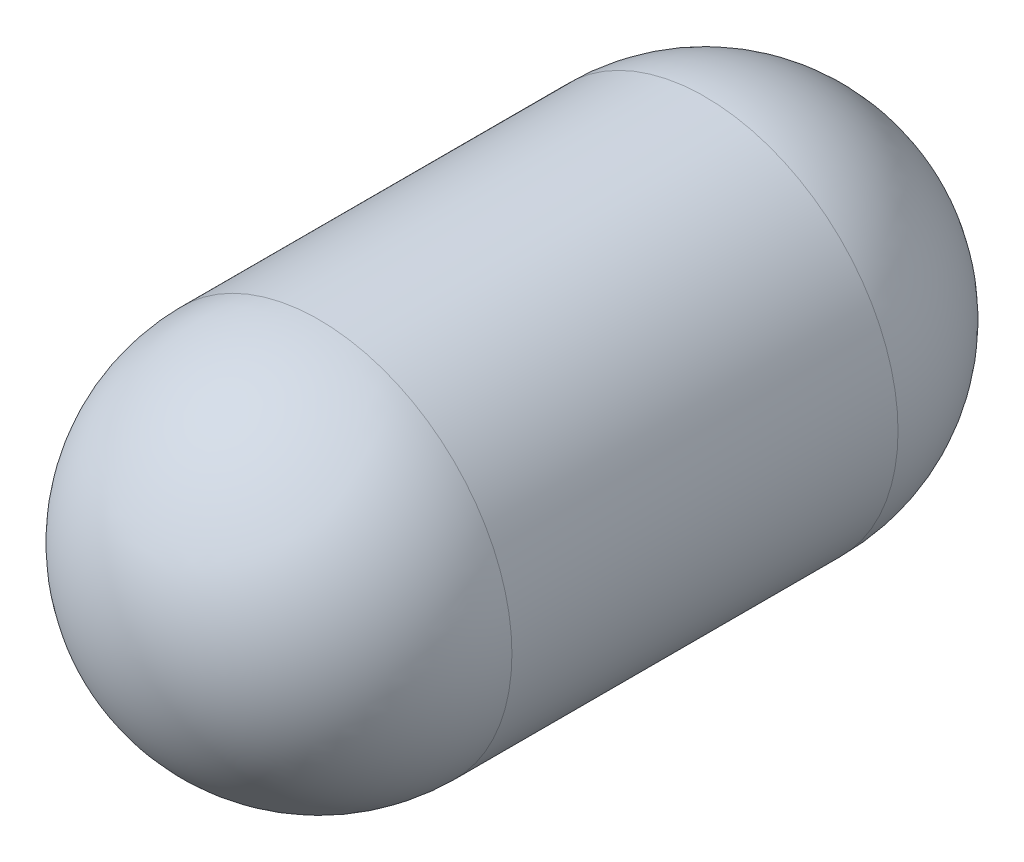
from build123d import *
from build123d.topology import SkipClean

# Parameters (mm, degrees)
BOSS_EXTRUDE1_DEPTH      = 0.5
BOSS_EXTRUDE1_DEPTH_BACK = 0.5
SKETCH1_R                = 0.5
DOME1_FACE_RADIUS        = 0.5
DOME1_HEIGHT             = 0.5
DOME2_FACE_RADIUS        = 0.5
DOME2_HEIGHT             = 0.5


with BuildPart() as part:
    # Sketch1 → Boss-Extrude1 (new, two sides: drawn at the far end of the back side and taken through both)
    with BuildSketch(Plane.XY.offset(-BOSS_EXTRUDE1_DEPTH_BACK)):
        Circle(SKETCH1_R)
    extrude(amount=BOSS_EXTRUDE1_DEPTH + BOSS_EXTRUDE1_DEPTH_BACK)

    # Dome1: a dome of height H over a round flat face of radius A is a cap of a sphere of radius (A * A + H * H) / (2 * H)
    dome1_r = (DOME1_FACE_RADIUS * DOME1_FACE_RADIUS + DOME1_HEIGHT * DOME1_HEIGHT) / (2 * DOME1_HEIGHT)
    dome1_base = Plane((0, 0, 0.5), z_dir=(0, 0, 1))
    with Locations(dome1_base.offset(DOME1_HEIGHT - dome1_r)):
        dome1_ball = Sphere(dome1_r, mode=Mode.PRIVATE)
    add(split(dome1_ball, bisect_by=dome1_base, keep=Keep.TOP, mode=Mode.PRIVATE))

    # Dome2: a dome of height H over a round flat face of radius A is a cap of a sphere of radius (A * A + H * H) / (2 * H)
    dome2_r = (DOME2_FACE_RADIUS * DOME2_FACE_RADIUS + DOME2_HEIGHT * DOME2_HEIGHT) / (2 * DOME2_HEIGHT)
    dome2_base = Plane((0, 0, -0.5), z_dir=(0, 0, -1))
    with Locations(dome2_base.offset(DOME2_HEIGHT - dome2_r)):
        dome2_ball = Sphere(dome2_r, mode=Mode.PRIVATE)
    add(split(dome2_ball, bisect_by=dome2_base, keep=Keep.TOP, mode=Mode.PRIVATE))


solid = part.part
